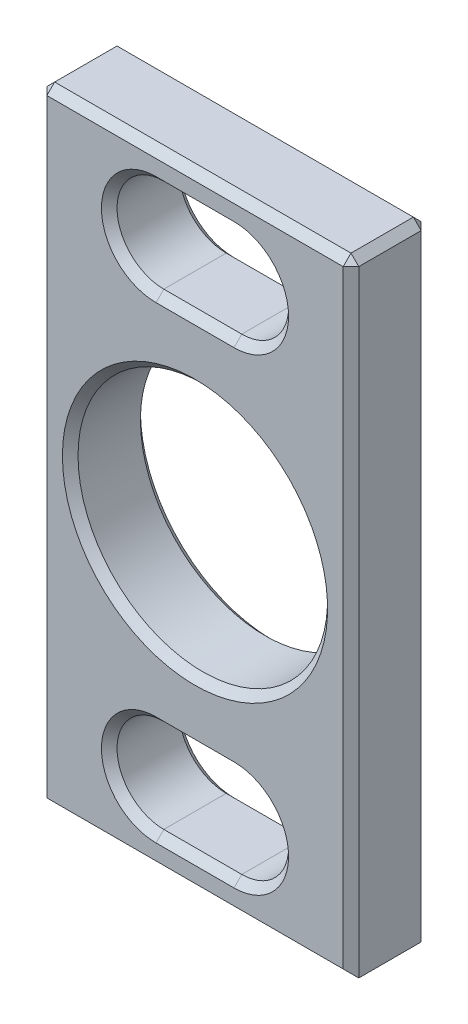
from build123d import *

# Parameters (mm, degrees)
ESQUISSE1_W             = 20
ESQUISSE1_H             = 40
BOSS_EXTRU_1_DEPTH      = 5
ESQUISSE5_R             = 8
ENL_V_MAT_EXTRU_2_DEPTH = 5
ENL_V_MAT_EXTRU_3_DEPTH = 46
CHANFREIN1_SIZE         = 0.5


with BuildPart() as part:
    # Esquisse1 → Boss.-Extru.1 (new body)
    with BuildSketch(Plane.XY):
        with Locations((10, 20)):
            Rectangle(ESQUISSE1_W, ESQUISSE1_H)
    extrude(amount=BOSS_EXTRU_1_DEPTH)

    # Esquisse5 → Enlèv. mat.-Extru.2 (cut)
    with BuildSketch(Plane.XY.offset(5)):
        with Locations((10, 20)):
            Circle(ESQUISSE5_R)
    extrude(amount=-ENL_V_MAT_EXTRU_2_DEPTH, mode=Mode.SUBTRACT)

    # Esquisse6 → Enlèv. mat.-Extru.3 (cut, through all)
    with BuildSketch(Plane.XY.offset(5)):
        with BuildLine():
            Line((7.5, 38), (12.5, 38))
            ThreePointArc((12.5, 38), (15.5, 35), (12.5, 32))
            Line((12.5, 32), (7.5, 32))
            ThreePointArc((7.5, 32), (4.5, 35), (7.5, 38))
        make_face()
        with BuildLine():
            Line((7.5, 2), (12.5, 2))
            ThreePointArc((12.5, 2), (15.5, 5), (12.5, 8))
            Line((12.5, 8), (7.5, 8))
            ThreePointArc((7.5, 8), (4.5, 5), (7.5, 2))
        make_face()
    extrude(amount=-ENL_V_MAT_EXTRU_3_DEPTH, mode=Mode.SUBTRACT)

    # Chanfrein1
    chanfrein1_edges = [part.edges().sort_by_distance(p)[0] for p in [
        (20, 20, 5),
        (10, 40, 5),
        (2, 20, 0),
        (2, 20, 5),
        (4.5, 35, 0),
        (10, 38, 0),
        (15.5, 35, 0),
        (10, 32, 0),
        (4.5, 35, 5),
        (10, 32, 5),
        (15.5, 35, 5),
        (10, 38, 5),
        (4.5, 5, 0),
        (10, 8, 0),
        (15.5, 5, 0),
        (10, 2, 0),
        (4.5, 5, 5),
        (10, 2, 5),
        (15.5, 5, 5),
        (10, 8, 5),
        (0, 20, 5),
        (10, 40, 0),
        (20, 20, 0),
        (0, 20, 0),
        (10, 0, 5),
        (0, 40, 2.5),
        (20, 40, 2.5),
        (0, 0, 2.5),
    ]]
    chamfer(chanfrein1_edges, length=CHANFREIN1_SIZE)


solid = part.part
